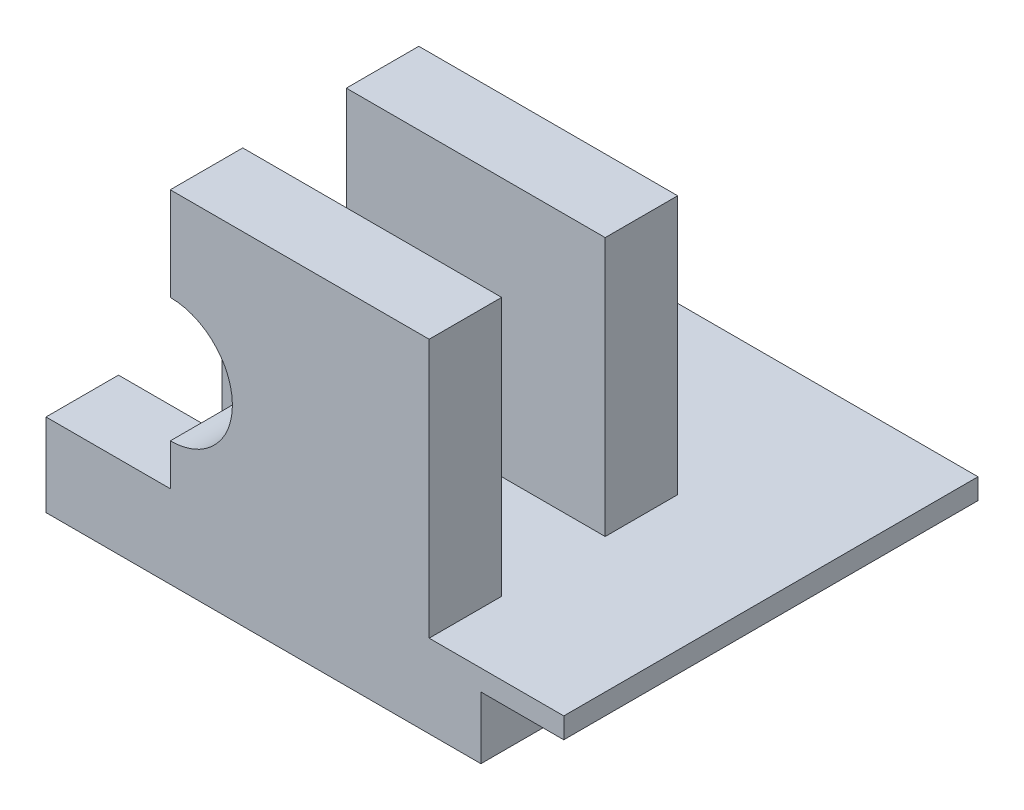
from build123d import *

# Parameters (mm, degrees)
EXTRUDE_1_DEPTH     = 40
SKETCH_2_R          = 7.5
SKETCH_2_W          = 12
SKETCH_2_H          = 10
CUT_EXTRUDE_1_DEPTH = 48.843494856
SKETCH_3_W          = 25
SKETCH_3_H          = 7
EXTRUDE_2_DEPTH     = 25
CUT_EXTRUDE_2_REACH = 57.371
SKETCH_4_R          = 6
SKETCH_6_W          = 8
SKETCH_6_H          = 8
CUT_EXTRUDE_3_DEPTH = 45.665422868


with BuildPart() as part:
    # Эскиз1 → Бобышка-Вытянуть1 (new body)
    with BuildSketch(Plane.XY):
        Polygon((-25, 4), (-25, -4), (17, -4), (17, 2), (25, 2), (25, 4), align=None)
    extrude(amount=EXTRUDE_1_DEPTH)

    # Эскиз2 → Вырез-Вытянуть1 (cut, through all)
    with BuildSketch(Plane(origin=(0, 4, 0), x_dir=(1, 0, 0), z_dir=(0, 1, 0))):
        with Locations((-15, 0)):
            Circle(SKETCH_2_R)
        with Locations((-19, -28)):
            Rectangle(SKETCH_2_W, SKETCH_2_H)
    extrude(amount=-CUT_EXTRUDE_1_DEPTH, mode=Mode.SUBTRACT)

    # Эскиз3 → Бобышка-Вытянуть2 (add)
    with BuildSketch(Plane(origin=(0, 4, 0), x_dir=(1, 0, 0), z_dir=(0, 1, 0))):
        with Locations((-0.5, -36.5)):
            Rectangle(SKETCH_3_W, SKETCH_3_H)
        with Locations((-0.5, -19.5)):
            Rectangle(SKETCH_3_W, SKETCH_3_H)
    extrude(amount=EXTRUDE_2_DEPTH)

    # Эскиз4 → Вырез-Вытянуть2 (cut, up to next)
    with BuildSketch(Plane.XY.offset(40), mode=Mode.PRIVATE) as cut_extrude_2_sk1:
        with Locations((-13, 14)):
            Circle(SKETCH_4_R)
    cut_extrude_2_tool1 = extrude(cut_extrude_2_sk1.sketch, amount=-CUT_EXTRUDE_2_REACH, mode=Mode.PRIVATE) & part.part
    add(cut_extrude_2_tool1.solids().sort_by_distance((-13, 14, 40))[0], mode=Mode.SUBTRACT)

    # Эскиз6 → Вырез-Вытянуть3 (cut, through all)
    with BuildSketch(Plane.XY.offset(23)):
        with Locations((-9, 12)):
            Rectangle(SKETCH_6_W, SKETCH_6_H)
    extrude(amount=-CUT_EXTRUDE_3_DEPTH, mode=Mode.SUBTRACT)


solid = part.part
